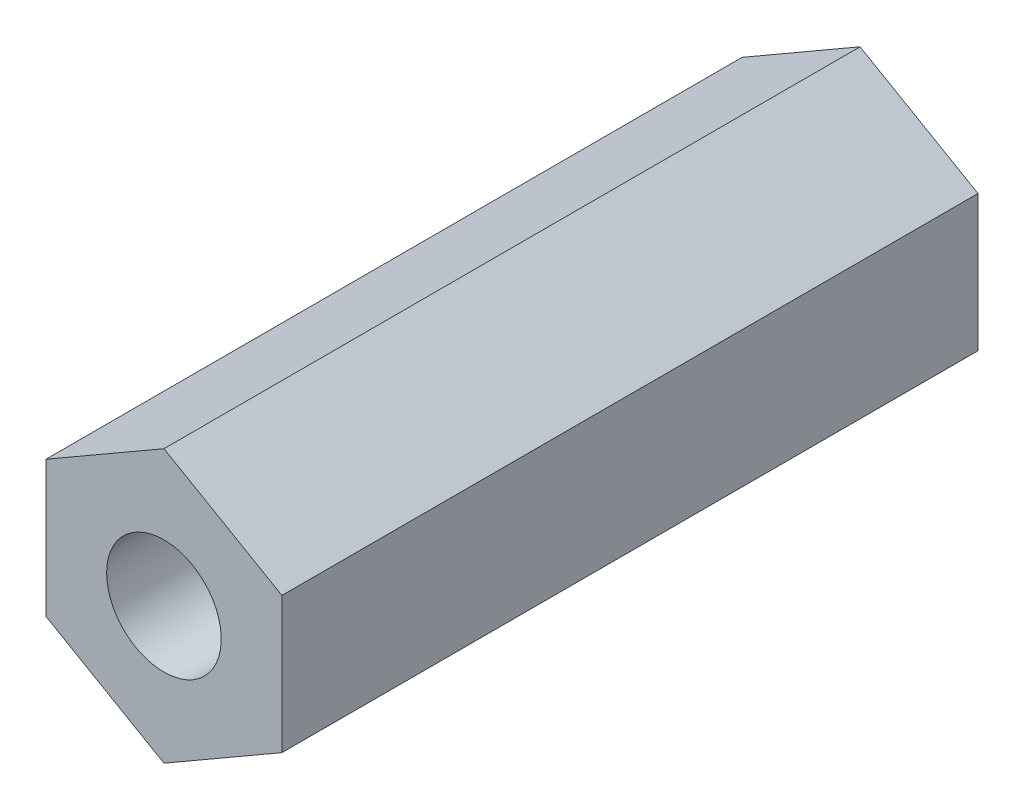
from build123d import *

# Parameters (mm, degrees)
HEX_7_START    = 42.85
HEX_7_DEPTH    = 20.65
ROSCA_M4_START = 42.85
CROQUIS2_R     = 1.7
ROSCA_M4_DEPTH = 20.65


with BuildPart() as part:
    # Croquis1 → Hex_7 (new body)
    with BuildSketch(Plane.XY.offset(HEX_7_START)):
        Polygon((39.498742631, 38.02), (36, 40.04), (32.501257369, 38.02), (32.501257369, 33.98), (36, 31.96), (39.498742631, 33.98), align=None)
    extrude(amount=HEX_7_DEPTH)

    # Croquis2 → Rosca_M4 (cut)
    with BuildSketch(Plane.XY.offset(ROSCA_M4_START)):
        with Locations(Location((36, 36, 0), (0, 0, 180))):
            Circle(CROQUIS2_R)
    extrude(amount=ROSCA_M4_DEPTH, mode=Mode.SUBTRACT)


solid = part.part
